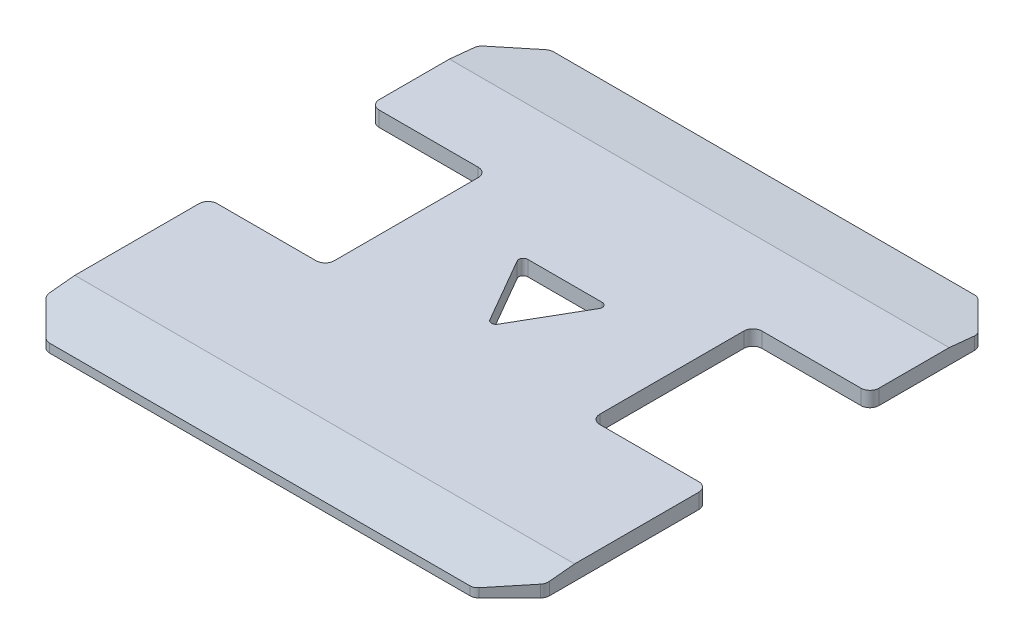
from build123d import *
from OCP.BRepFilletAPI import BRepFilletAPI_MakeChamfer

# Parameters (mm, degrees)
SKETCH1_W           = 27.75
SKETCH1_H           = 28
BOSS_EXTRUDE1_DEPTH = 0.84
CUT_EXTRUDE1_REACH  = 21.729
SKETCH2_W           = 6.5
SKETCH2_H           = 9
CHAMFER1_SIZE       = 2
CHAMFER2_SIZE       = 0.36
CHAMFER2_SIZE2      = 3.6
FILLET1_R           = 0.5
FILLET2_R           = 0.25


with BuildPart() as part:
    # Sketch1 → Boss-Extrude1 (new body)
    with BuildSketch(Plane(origin=(0, 0, 0), x_dir=(1, 0, 0), z_dir=(0, 1, 0))):
        Rectangle(SKETCH1_W, SKETCH1_H)
    extrude(amount=BOSS_EXTRUDE1_DEPTH)

    # Sketch2 → Cut-Extrude1 (cut, up to next)
    with BuildSketch(Plane(origin=(0, 0, 0), x_dir=(1, 0, 0), z_dir=(0, 1, 0)), mode=Mode.PRIVATE) as cut_extrude1_sk1:
        with Locations((-10.625, 1.5)):
            Rectangle(SKETCH2_W, SKETCH2_H)
    cut_extrude1_tool1 = extrude(cut_extrude1_sk1.sketch, amount=CUT_EXTRUDE1_REACH, mode=Mode.PRIVATE) & part.part
    # Sketch2 → Cut-Extrude1 (cut, up to next)
    with BuildSketch(Plane(origin=(0, 0, 0), x_dir=(1, 0, 0), z_dir=(0, 1, 0)), mode=Mode.PRIVATE) as cut_extrude1_sk2:
        with Locations((10.625, 1.5)):
            Rectangle(SKETCH2_W, SKETCH2_H)
    cut_extrude1_tool2 = extrude(cut_extrude1_sk2.sketch, amount=CUT_EXTRUDE1_REACH, mode=Mode.PRIVATE) & part.part
    # Sketch2 → Cut-Extrude1 (cut, up to next)
    with BuildSketch(Plane(origin=(0, 0, 0), x_dir=(1, 0, 0), z_dir=(0, 1, 0)), mode=Mode.PRIVATE) as cut_extrude1_sk3:
        Polygon((0, -1.386751346), (2.5, 2.943375673), (-2.5, 2.943375673), align=None)
    cut_extrude1_tool3 = extrude(cut_extrude1_sk3.sketch, amount=CUT_EXTRUDE1_REACH, mode=Mode.PRIVATE) & part.part
    add(cut_extrude1_tool1.solids().sort_by_distance((-10.625, 0, -1.5))[0], mode=Mode.SUBTRACT)
    add(cut_extrude1_tool2.solids().sort_by_distance((10.625, 0, -1.5))[0], mode=Mode.SUBTRACT)
    add(cut_extrude1_tool3.solids().sort_by_distance((0, 0, -1.5))[0], mode=Mode.SUBTRACT)

    # Chamfer1
    chamfer1_edges = [part.edges().sort_by_distance(p)[0] for p in [
        (-13.875, 0.42, -14),
        (13.875, 0.42, -14),
        (13.875, 0.42, 14),
        (-13.875, 0.42, 14),
    ]]
    chamfer(chamfer1_edges, length=CHAMFER1_SIZE)

    # Chamfer2: one chamfer whose edges measure the first distance from different faces: ONE call of the kernel's chamfer builder (chamfer() names one face for all edges)
    chamfer2_edges_1 = [part.edges().sort_by_distance(p)[0] for p in [
        (0, 0.84, -14),
    ]]
    chamfer2_side_1 = [part.faces().sort_by_distance(p)[0] for p in [
        (0, 0.42, -14),
    ]]
    chamfer2_edges_2 = [part.edges().sort_by_distance(p)[0] for p in [
        (0, 0.84, 14),
    ]]
    chamfer2_side_2 = [part.faces().sort_by_distance(p)[0] for p in [
        (0, 0.42, 14),
    ]]
    chamfer2 = BRepFilletAPI_MakeChamfer(part.part.solid().wrapped)
    for e in chamfer2_edges_1:
        chamfer2.Add(CHAMFER2_SIZE, CHAMFER2_SIZE2, e.wrapped, chamfer2_side_1[0].wrapped)  # the first distance lies on this face
    for e in chamfer2_edges_2:
        chamfer2.Add(CHAMFER2_SIZE, CHAMFER2_SIZE2, e.wrapped, chamfer2_side_2[0].wrapped)  # the first distance lies on this face
    add(Compound.cast(chamfer2.Shape()), mode=Mode.REPLACE)

    # Fillet1
    fillet1_edges = [part.edges().sort_by_distance(p)[0] for p in [
        (-7.375, 0.42, 3),
        (-7.375, 0.42, -6),
        (-13.875, 0.42, -6),
        (-13.875, 0.42, 3),
        (13.875, 0.42, 3),
        (13.875, 0.42, -6),
        (7.375, 0.42, -6),
        (7.375, 0.42, 3),
        (11.875, 0.24, 14),
        (-13.875, 0.34, 12),
        (-11.875, 0.24, -14),
        (13.875, 0.34, -12),
        (-13.875, 0.34, -12),
        (11.875, 0.24, -14),
        (13.875, 0.34, 12),
        (-11.875, 0.24, 14),
    ]]
    fillet(fillet1_edges, radius=FILLET1_R)

    # Fillet2
    fillet2_edges = [part.edges().sort_by_distance(p)[0] for p in [
        (-2.5, 0.42, -2.943375673),
        (0, 0.42, 1.386751346),
        (2.5, 0.42, -2.943375673),
    ]]
    fillet(fillet2_edges, radius=FILLET2_R)


solid = part.part
